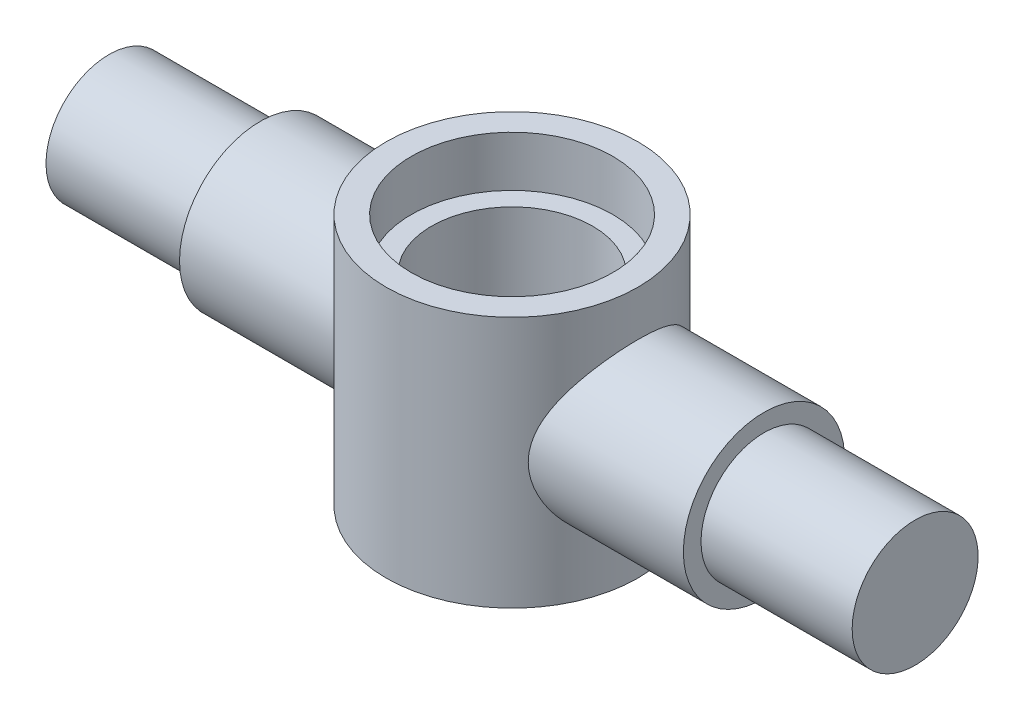
from build123d import *

# Parameters (mm, degrees)
SKETCH1_W = 25
SKETCH1_H = 50


with BuildPart() as part:
    # Sketch1 → Revolve1 (revolve)
    with BuildSketch(Plane.XY, mode=Mode.PRIVATE) as revolve1_sk:
        with Locations((12.5, 0)):
            Rectangle(SKETCH1_W, SKETCH1_H)
    revolve(revolve1_sk.sketch.rotate(Axis((0, 25, 0), (0, -1, 0)), 180), axis=Axis((0, 25, 0), (0, -1, 0)))

    # Sketch2 → Revolve2 (revolve)
    with BuildSketch(Plane.XY, mode=Mode.PRIVATE) as revolve2_sk:
        Polygon((-80, 0), (80, 0), (80, 12.5), (50, 12.5), (50, 16), (-50, 16), (-50, 12.5), (-80, 12.5), align=None)
    revolve(revolve2_sk.sketch.rotate(Axis((-80, 0, 0), (1, 0, 0)), 90), axis=Axis((-80, 0, 0), (1, 0, 0)))

    # Sketch3 → Cut-Revolve1 (revolve, cut)
    with BuildSketch(Plane.XY, mode=Mode.PRIVATE) as cut_revolve1_sk:
        Polygon((0, 25), (20, 25), (20, 15), (16, 15), (16, -25), (0, -25), align=None)
    revolve(cut_revolve1_sk.sketch.rotate(Axis((0, -25, 0), (0, 1, 0)), 90), axis=Axis((0, -25, 0), (0, 1, 0)), mode=Mode.SUBTRACT)


solid = part.part
